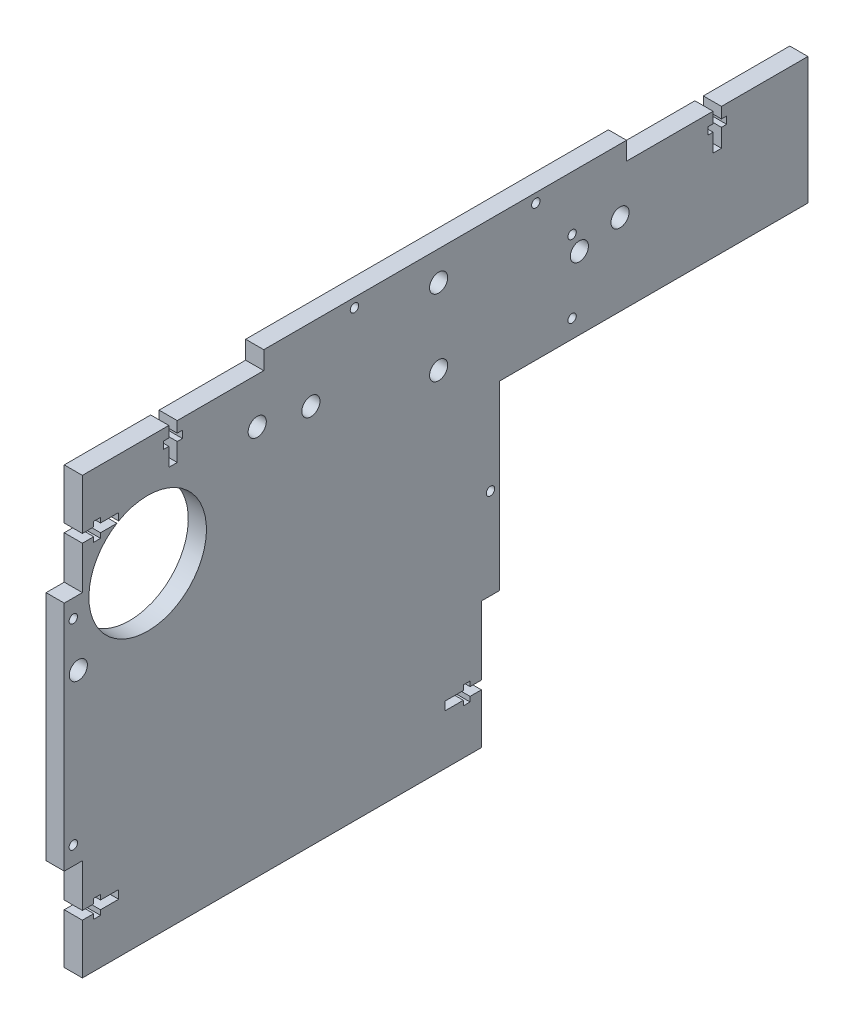
from build123d import *

# Parameters (mm, degrees)
BOSS_EXTRUDE1_DEPTH = 6.35
CUT_EXTRUDE1_DEPTH  = 300.596203247
SKETCH4_W           = 6.35
SKETCH4_H           = 81.28
SKETCH4_H_2         = 63.5
BOSS_EXTRUDE3_DEPTH = 6.35
SKETCH5_R           = 1.4732
CUT_EXTRUDE2_DEPTH  = 300.596203247
SKETCH6_R           = 3.175
SKETCH6_R_2         = 3.174999999
SKETCH6_R_3         = 1.4732
CUT_EXTRUDE3_DEPTH  = 300.596203247
CUT_EXTRUDE4_REACH  = 301.596
SKETCH7_R           = 3.1763843
SKETCH8_R           = 1.4605
CUT_EXTRUDE5_DEPTH  = 300.596203247
SKETCH11_R          = 20.574
CUT_EXTRUDE6_DEPTH  = 25.4


with BuildPart() as part:
    # Sketch1 → Boss-Extrude1 (new body)
    with BuildSketch(Plane(origin=(0, 0, 0), x_dir=(0, 0, -1), z_dir=(1, 0, 0))):
        Polygon((63.5, 158.75), (139.7, 158.75), (190.5, 158.75), (190.5, 152.4), (254, 152.4), (254, 107.95), (139.7, 107.95), (139.7, 0), (0, 0), (0, 152.4), (63.5, 152.4), align=None)
    extrude(amount=BOSS_EXTRUDE1_DEPTH)

    # Sketch2 → Cut-Extrude1 (cut, through all)
    with BuildSketch(Plane.ZY):
        Polygon((0, 17.526), (-3.96875, 17.526), (-3.96875, 15.8242), (-6.35, 15.8242), (-6.35, 17.526), (-12.7, 17.526), (-12.7, 20.4724), (-6.35, 20.4724), (-6.35, 22.1742), (-3.96875, 22.1742), (-3.96875, 20.4724), (0, 20.4724), align=None)
        Polygon((-139.7, 17.526), (-139.7, 20.4724), (-135.73125, 20.4724), (-135.73125, 22.1742), (-133.35, 22.1742), (-133.35, 20.4724), (-127, 20.4724), (-127, 17.526), (-133.35, 17.526), (-133.35, 15.8242), (-135.73125, 15.8242), (-135.73125, 17.526), align=None)
        Polygon((-12.7, 134.7724), (-12.7, 131.826), (-6.35, 131.826), (-6.35, 130.1242), (-3.96875, 130.1242), (-3.96875, 131.826), (0, 131.826), (0, 134.7724), (-3.96875, 134.7724), (-3.96875, 136.4742), (-6.35, 136.4742), (-6.35, 134.7724), align=None)
    extrude(amount=-CUT_EXTRUDE1_DEPTH, mode=Mode.SUBTRACT)

    # Sketch4 → Boss-Extrude3 (add)
    with BuildSketch(Plane.ZY):
        with Locations((3.175, 76.2)):
            Rectangle(SKETCH4_W, SKETCH4_H)
        with Locations((-142.875, 76.2)):
            Rectangle(SKETCH4_W, SKETCH4_H_2)
    extrude(amount=-BOSS_EXTRUDE3_DEPTH)

    # Sketch5 → Cut-Extrude2 (cut, through all)
    with BuildSketch(Plane.ZY):
        with Locations(Location((3.175, 41.91, 0), (0, 0, 180))):
            Circle(SKETCH5_R)
        with Locations((-142.875, 76.2)):
            Circle(SKETCH5_R)
        with Locations((3.175, 110.49)):
            Circle(SKETCH5_R)
    extrude(amount=-CUT_EXTRUDE2_DEPTH, mode=Mode.SUBTRACT)

    # Sketch6 → Cut-Extrude3 (cut, through all)
    with BuildSketch(Plane.ZY):
        with Locations((-61.214, 136.503809763)):
            Circle(SKETCH6_R)
        with Locations((-80.009999999, 133.35)):
            Circle(SKETCH6_R_2)
        with Locations((-95.25, 155.575)):
            Circle(SKETCH6_R_3)
        with Locations((-158.75, 155.575)):
            Circle(SKETCH6_R_3)
        with Locations((-188.224, 136.50380976)):
            Circle(SKETCH6_R)
        with Locations((-173.99, 133.35)):
            Circle(SKETCH6_R)
        with Locations((-124.719, 148.476804798)):
            Circle(SKETCH6_R)
        with Locations((-124.719, 121.898809762)):
            Circle(SKETCH6_R)
        Polygon((-30.2641, 152.4), (-33.2105, 152.4), (-33.2105, 148.59), (-35.0393, 148.59), (-35.0393, 146.05), (-33.2105, 146.05), (-33.2105, 139.7), (-30.2641, 139.7), (-30.2641, 146.05), (-28.4353, 146.05), (-28.4353, 148.59), (-30.2641, 148.59), align=None)
        Polygon((-220.7895, 152.4), (-223.7359, 152.4), (-223.7359, 148.59), (-225.5647, 148.59), (-225.5647, 146.05), (-223.7359, 146.05), (-223.7359, 139.7), (-220.7895, 139.7), (-220.7895, 146.05), (-218.9607, 146.05), (-218.9607, 148.59), (-220.7895, 148.59), align=None)
    extrude(amount=-CUT_EXTRUDE3_DEPTH, mode=Mode.SUBTRACT)

    # Sketch7 → Cut-Extrude4 (cut, up to next)
    with BuildSketch(Plane(origin=(6.35, 0, 0), x_dir=(0, 0, -1), z_dir=(1, 0, 0)), mode=Mode.PRIVATE) as cut_extrude4_sk1:
        with Locations((-1.419543332, 94.061078275)):
            Circle(SKETCH7_R)
    cut_extrude4_tool1 = extrude(cut_extrude4_sk1.sketch, amount=-CUT_EXTRUDE4_REACH, mode=Mode.PRIVATE) & part.part
    add(cut_extrude4_tool1.solids().sort_by_distance((6.35, 94.061078, 1.419543))[0], mode=Mode.SUBTRACT)

    # Sketch8 → Cut-Extrude5 (cut, through all)
    with BuildSketch(Plane.ZY):
        with Locations((-171.45, 114.3)):
            Circle(SKETCH8_R)
        with Locations((-171.45, 139.7)):
            Circle(SKETCH8_R)
    extrude(amount=-CUT_EXTRUDE5_DEPTH, mode=Mode.SUBTRACT)

    # Sketch11 → Cut-Extrude6 (cut)
    with BuildSketch(Plane.ZY):
        with Locations((-22.86, 114.3)):
            Circle(SKETCH11_R)
    extrude(amount=-CUT_EXTRUDE6_DEPTH, mode=Mode.SUBTRACT)


solid = part.part
